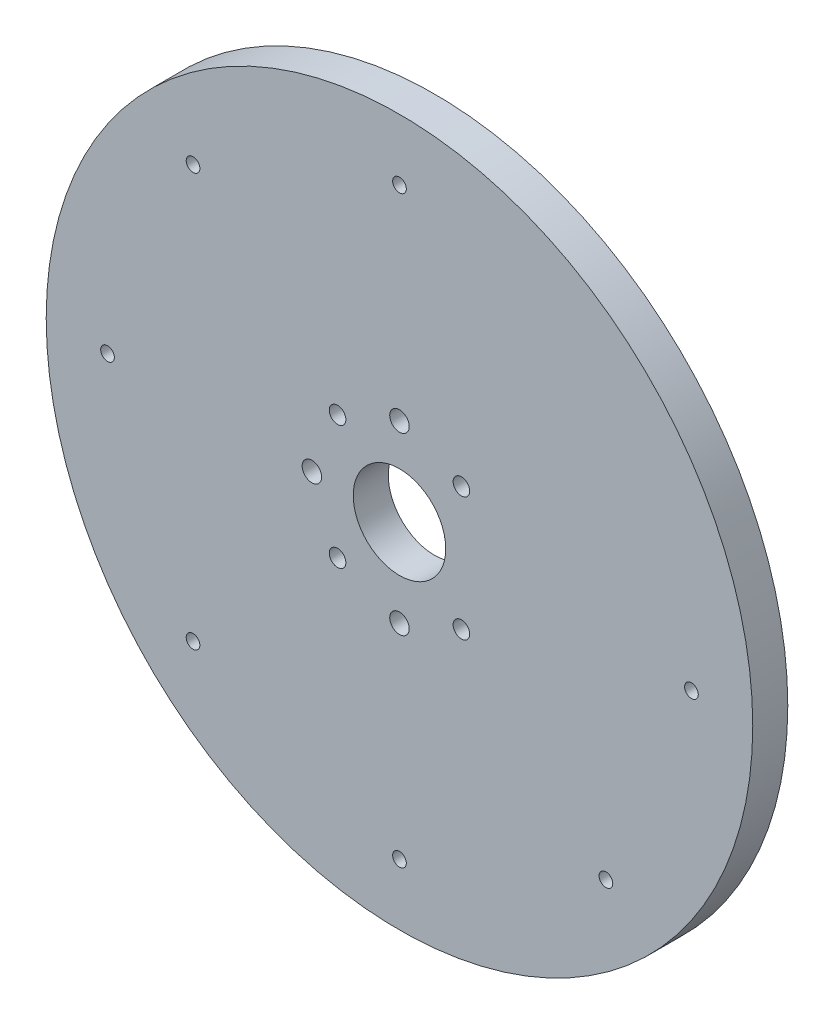
from build123d import *

# Parameters (mm, degrees)
SKETCH1_R           = 60.5
SKETCH1_R_2         = 1.25
SKETCH1_R_3         = 8
SKETCH1_R_4         = 1.75
SKETCH1_R_5         = 1.5
BOSS_EXTRUDE1_DEPTH = 6
MOVE_FACE1_BY       = 0.08
MOVE_FACE1_2_BY     = 0.08
MOVE_FACE1_3_BY     = 0.08
MOVE_FACE1_4_BY     = 0.08
MOVE_FACE1_5_BY     = 0.08
MOVE_FACE1_6_BY     = 0.08
MOVE_FACE1_7_BY     = 0.08
MOVE_FACE1_8_BY     = 0.08
MOVE_FACE1_9_BY     = 0.08
MOVE_FACE1_10_BY    = 0.08
MOVE_FACE1_11_BY    = 0.08
MOVE_FACE1_12_BY    = 0.08
MOVE_FACE1_13_BY    = 0.08
MOVE_FACE1_14_BY    = 0.08
MOVE_FACE1_15_BY    = 0.08


with BuildPart() as part:
    # Sketch1 → Boss-Extrude1 (new body)
    with BuildSketch(Plane.XY):
        Circle(SKETCH1_R)
        with Locations((35.355339059, -35.355339059)):
            Circle(SKETCH1_R_2, mode=Mode.SUBTRACT)
        Circle(SKETCH1_R_3, mode=Mode.SUBTRACT)
        with Locations((0, -15)):
            Circle(SKETCH1_R_4, mode=Mode.SUBTRACT)
        with Locations((10.606601718, -10.606601718)):
            Circle(SKETCH1_R_5, mode=Mode.SUBTRACT)
        with Locations((0, -50)):
            Circle(SKETCH1_R_2, mode=Mode.SUBTRACT)
        with Locations((-15, 0)):
            Circle(SKETCH1_R_4, mode=Mode.SUBTRACT)
        with Locations((-10.606601718, -10.606601718)):
            Circle(SKETCH1_R_5, mode=Mode.SUBTRACT)
        with Locations((0, 15)):
            Circle(SKETCH1_R_4, mode=Mode.SUBTRACT)
        with Locations((-10.606601718, 10.606601718)):
            Circle(SKETCH1_R_5, mode=Mode.SUBTRACT)
        with Locations((10.606601718, 10.606601718)):
            Circle(SKETCH1_R_5, mode=Mode.SUBTRACT)
        with Locations((-35.355339059, -35.355339059)):
            Circle(SKETCH1_R_2, mode=Mode.SUBTRACT)
        with Locations((-50, 0)):
            Circle(SKETCH1_R_2, mode=Mode.SUBTRACT)
        with Locations((-35.355339059, 35.355339059)):
            Circle(SKETCH1_R_2, mode=Mode.SUBTRACT)
        with Locations((0, 50)):
            Circle(SKETCH1_R_2, mode=Mode.SUBTRACT)
        with Locations((50, 0)):
            Circle(SKETCH1_R_2, mode=Mode.SUBTRACT)
    extrude(amount=BOSS_EXTRUDE1_DEPTH)

    # Move Face1: a curved face moved outward by 0.08
    add(Solid.thicken(part.faces().sort_by_distance((34.105339059, -35.355339059, 3))[0], MOVE_FACE1_BY))

    # Move Face1 2: a curved face moved outward by 0.08
    add(Solid.thicken(part.faces().sort_by_distance((-8, 0, 3))[0], MOVE_FACE1_2_BY))

    # Move Face1 3: a curved face moved outward by 0.08
    add(Solid.thicken(part.faces().sort_by_distance((-1.75, -15, 3))[0], MOVE_FACE1_3_BY))

    # Move Face1 4: a curved face moved outward by 0.08
    add(Solid.thicken(part.faces().sort_by_distance((9.106601718, -10.606601718, 3))[0], MOVE_FACE1_4_BY))

    # Move Face1 5: a curved face moved outward by 0.08
    add(Solid.thicken(part.faces().sort_by_distance((-1.25, -50, 3))[0], MOVE_FACE1_5_BY))

    # Move Face1 6: a curved face moved outward by 0.08
    add(Solid.thicken(part.faces().sort_by_distance((-36.605339059, -35.355339059, 3))[0], MOVE_FACE1_6_BY))

    # Move Face1 7: a curved face moved outward by 0.08
    add(Solid.thicken(part.faces().sort_by_distance((-16.75, 0, 3))[0], MOVE_FACE1_7_BY))

    # Move Face1 8: a curved face moved outward by 0.08
    add(Solid.thicken(part.faces().sort_by_distance((-12.106601718, -10.606601718, 3))[0], MOVE_FACE1_8_BY))

    # Move Face1 9: a curved face moved outward by 0.08
    add(Solid.thicken(part.faces().sort_by_distance((-1.75, 15, 3))[0], MOVE_FACE1_9_BY))

    # Move Face1 10: a curved face moved outward by 0.08
    add(Solid.thicken(part.faces().sort_by_distance((-12.106601718, 10.606601718, 3))[0], MOVE_FACE1_10_BY))

    # Move Face1 11: a curved face moved outward by 0.08
    add(Solid.thicken(part.faces().sort_by_distance((9.106601718, 10.606601718, 3))[0], MOVE_FACE1_11_BY))

    # Move Face1 12: a curved face moved outward by 0.08
    add(Solid.thicken(part.faces().sort_by_distance((-51.25, 0, 3))[0], MOVE_FACE1_12_BY))

    # Move Face1 13: a curved face moved outward by 0.08
    add(Solid.thicken(part.faces().sort_by_distance((-36.605339059, 35.355339059, 3))[0], MOVE_FACE1_13_BY))

    # Move Face1 14: a curved face moved outward by 0.08
    add(Solid.thicken(part.faces().sort_by_distance((-1.25, 50, 3))[0], MOVE_FACE1_14_BY))

    # Move Face1 15: a curved face moved outward by 0.08
    add(Solid.thicken(part.faces().sort_by_distance((48.75, 0, 3))[0], MOVE_FACE1_15_BY))


solid = part.part
